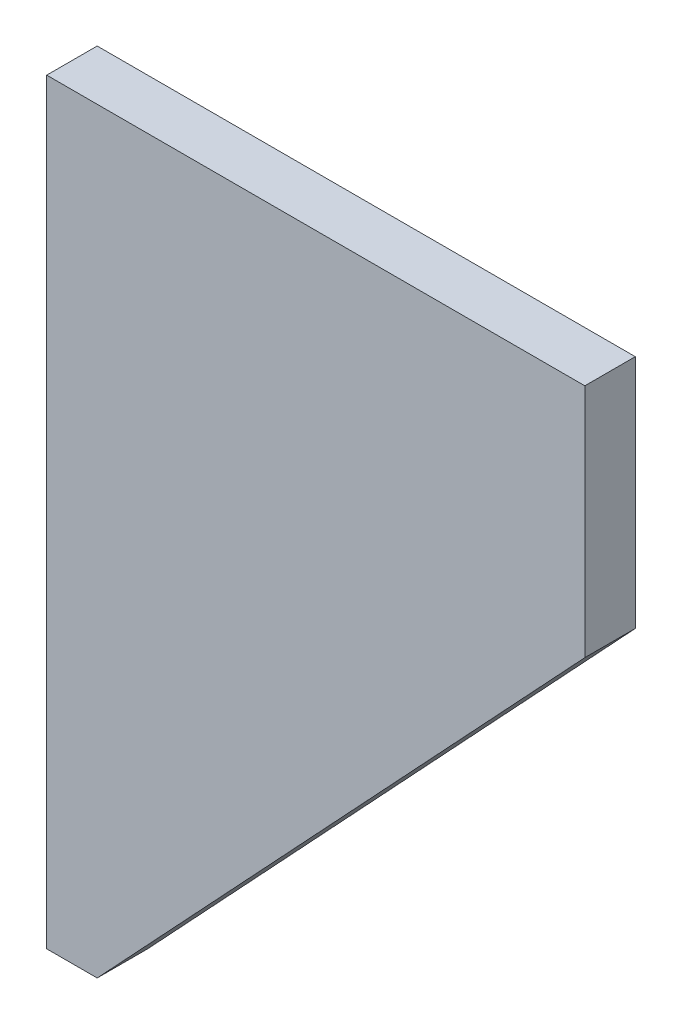
from build123d import *

# Parameters (mm, degrees)
BOSS_EXTRUDE1_DEPTH = 19.05


with BuildPart() as part:
    # Sketch1 → Boss-Extrude1 (new body)
    with BuildSketch(Plane.XY):
        Polygon((0, 0), (0, 285.75), (203.2, 285.75), (203.2, 196.85), (19.05, 0), align=None)
    extrude(amount=BOSS_EXTRUDE1_DEPTH)


solid = part.part
